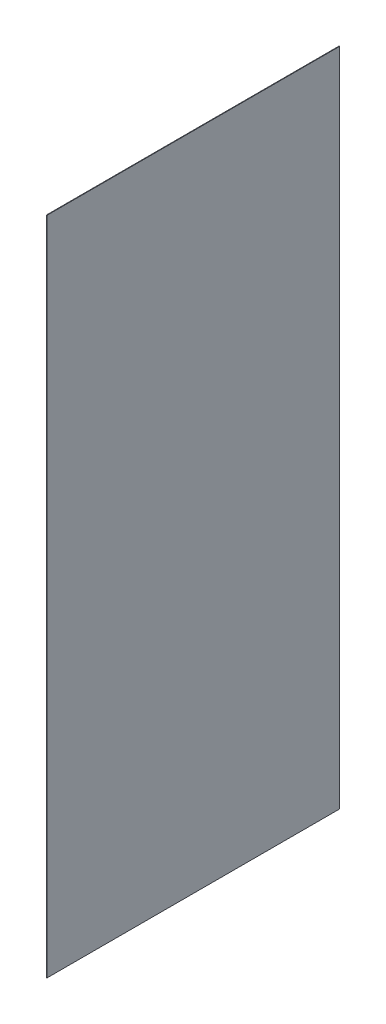
from build123d import *

# Parameters (mm, degrees)
SKETCH1_W                = 1.5
SKETCH1_H                = 1850
OVEN_DIS_YAN_SOL_1_DEPTH = 820


with BuildPart() as part:
    # Sketch1 → OVEN_dis_yan_sol_1 (new body)
    with BuildSketch(Plane.XY):
        with Locations((0.75, 1045)):
            Rectangle(SKETCH1_W, SKETCH1_H)
    extrude(amount=-OVEN_DIS_YAN_SOL_1_DEPTH)


solid = part.part
